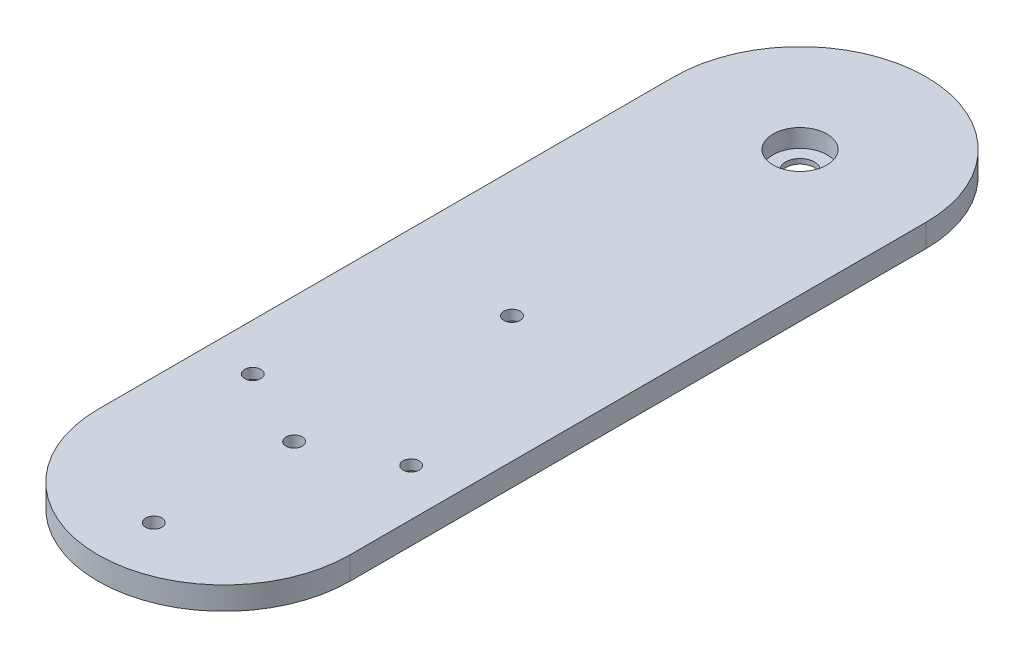
from build123d import *

# Parameters (mm, degrees)
PLACA_START                   = -53.1
SK_PLACA_W                    = 70
SK_PLACA_H                    = 160
PLACA_DEPTH                   = 6.35
EXTREMOS_START                = -53.1
SK_EXTREMOS_R                 = 35
EXTREMOS_DEPTH                = 6.35
PASANTES_M4_SEPARADORES_START = -53.1
SK_PASANTES_M4_SEPARADORES_R  = 2.25
PASANTES_M4_SEPARADORES_DEPTH = 6.35
ALOJAMIENTO_696ZZ_START       = -51.75
SK_ALOJAMIENTO_696ZZ_R        = 7.475
ALOJAMIENTO_696ZZ_DEPTH       = 5
PASO_EXTRACTOR_START          = -53.1
SK_PASO_EXTRACTOR_R           = 4
PASO_EXTRACTOR_DEPTH          = 1.35
PASANTES_M4_EJEFALSO_J3_START = -53.1
SK_PASANTES_M4_EJEFALSO_J3_R  = 2.25
PASANTES_M4_EJEFALSO_J3_DEPTH = 6.35
SK_CAJAS_M4_SEPARADORES_R     = 4
CAJAS_M4_SEPARADORES_DEPTH    = 3.5


with BuildPart() as part:
    # Sk_Placa → Placa (new body)
    with BuildSketch(Plane(origin=(0, 0, 0), x_dir=(1, 0, 0), z_dir=(0, 1, 0)).offset(PLACA_START)):
        with Locations((0, -250)):
            Rectangle(SK_PLACA_W, SK_PLACA_H)
    extrude(amount=PLACA_DEPTH)

    # Sk_Extremos → Extremos (add)
    with BuildSketch(Plane(origin=(0, 0, 0), x_dir=(1, 0, 0), z_dir=(0, 1, 0)).offset(EXTREMOS_START)):
        with Locations((0, -170)):
            Circle(SK_EXTREMOS_R)
        with Locations((0, -330)):
            Circle(SK_EXTREMOS_R)
    extrude(amount=EXTREMOS_DEPTH)

    # Sk_Pasantes_M4_separadores → Pasantes_M4_separadores (cut)
    with BuildSketch(Plane(origin=(0, 0, 0), x_dir=(1, 0, 0), z_dir=(0, 1, 0)).offset(PASANTES_M4_SEPARADORES_START)):
        with Locations(Location((0, -250, 0), (0, 0, 270))):
            Circle(SK_PASANTES_M4_SEPARADORES_R)
        with Locations(Location((-22, -300, 0), (0, 0, 270))):
            Circle(SK_PASANTES_M4_SEPARADORES_R)
        with Locations(Location((22, -300, 0), (0, 0, 270))):
            Circle(SK_PASANTES_M4_SEPARADORES_R)
    extrude(amount=PASANTES_M4_SEPARADORES_DEPTH, mode=Mode.SUBTRACT)

    # Sk_Alojamiento_696ZZ → Alojamiento_696ZZ (cut)
    with BuildSketch(Plane(origin=(0, 0, 0), x_dir=(1, 0, 0), z_dir=(0, 1, 0)).offset(ALOJAMIENTO_696ZZ_START)):
        with Locations(Location((0, -170, 0), (0, 0, 270))):
            Circle(SK_ALOJAMIENTO_696ZZ_R)
    extrude(amount=ALOJAMIENTO_696ZZ_DEPTH, mode=Mode.SUBTRACT)

    # Sk_Paso_extractor → Paso_extractor (cut)
    with BuildSketch(Plane(origin=(0, 0, 0), x_dir=(1, 0, 0), z_dir=(0, 1, 0)).offset(PASO_EXTRACTOR_START)):
        with Locations(Location((0, -170, 0), (0, 0, 90))):
            Circle(SK_PASO_EXTRACTOR_R)
    extrude(amount=PASO_EXTRACTOR_DEPTH, mode=Mode.SUBTRACT)

    # Sk_Pasantes_M4_ejefalso_J3 → Pasantes_M4_ejefalso_J3 (cut)
    with BuildSketch(Plane(origin=(0, 0, 0), x_dir=(1, 0, 0), z_dir=(0, 1, 0)).offset(PASANTES_M4_EJEFALSO_J3_START)):
        with Locations(Location((0, -310.5, 0), (0, 0, 270))):
            Circle(SK_PASANTES_M4_EJEFALSO_J3_R)
        with Locations(Location((0, -349.5, 0), (0, 0, 270))):
            Circle(SK_PASANTES_M4_EJEFALSO_J3_R)
    extrude(amount=PASANTES_M4_EJEFALSO_J3_DEPTH, mode=Mode.SUBTRACT)

    # Sk_Cajas_M4_separadores → Cajas_M4_separadores (cut)
    with BuildSketch(Plane.XZ.offset(53.1)):
        with Locations(Location((0, 250, 0), (0, 0, 270))):
            Circle(SK_CAJAS_M4_SEPARADORES_R)
        with Locations(Location((22, 300, 0), (0, 0, 270))):
            Circle(SK_CAJAS_M4_SEPARADORES_R)
        with Locations(Location((-22, 300, 0), (0, 0, 270))):
            Circle(SK_CAJAS_M4_SEPARADORES_R)
    extrude(amount=-CAJAS_M4_SEPARADORES_DEPTH, mode=Mode.SUBTRACT)


solid = part.part
